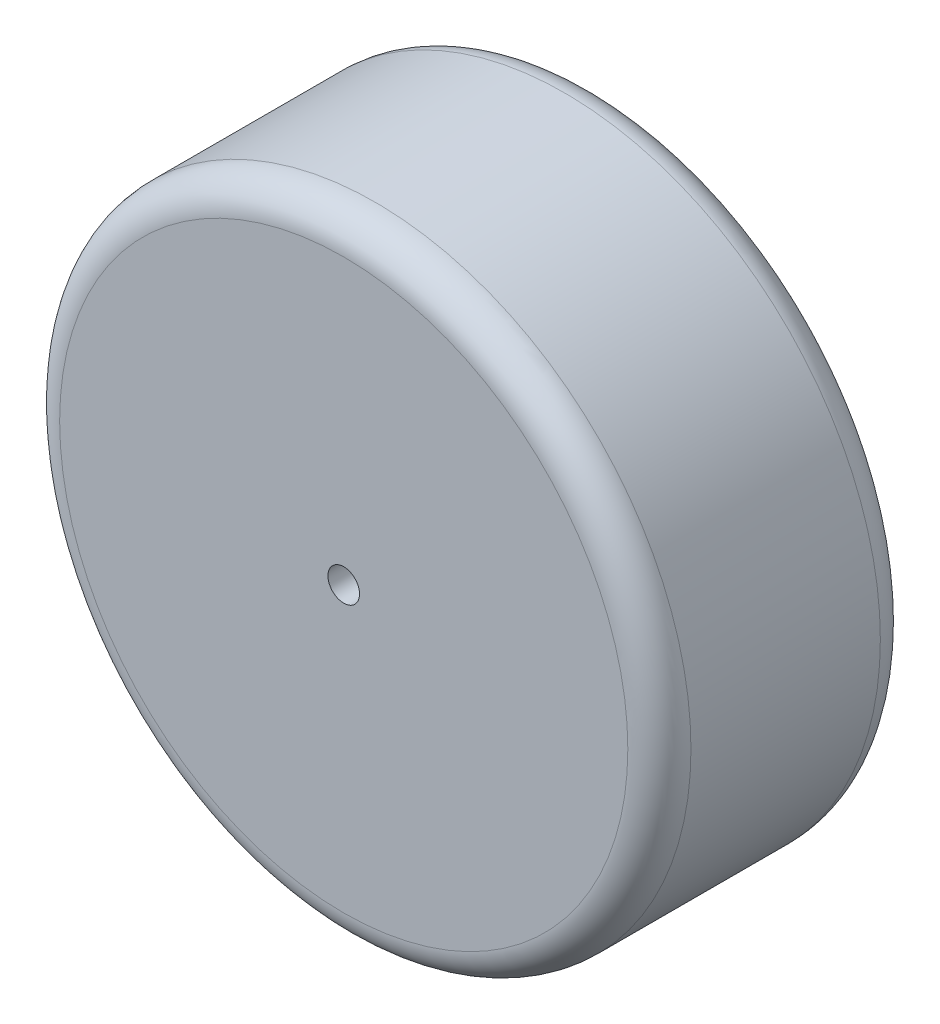
from build123d import *

# Parameters (mm, degrees)
SKETCH1_R           = 100
SKETCH1_R_2         = 5
BOSS_EXTRUDE1_DEPTH = 80
FILLET1_R           = 10


with BuildPart() as part:
    # Sketch1 → Boss-Extrude1 (new body)
    with BuildSketch(Plane.XY):
        Circle(SKETCH1_R)
        Circle(SKETCH1_R_2, mode=Mode.SUBTRACT)
    extrude(amount=BOSS_EXTRUDE1_DEPTH)

    # Fillet1
    fillet1_edges = [part.edges().sort_by_distance(p)[0] for p in [
        (-100, 0, 0),
        (-100, 0, 80),
    ]]
    fillet(fillet1_edges, radius=FILLET1_R)


solid = part.part
